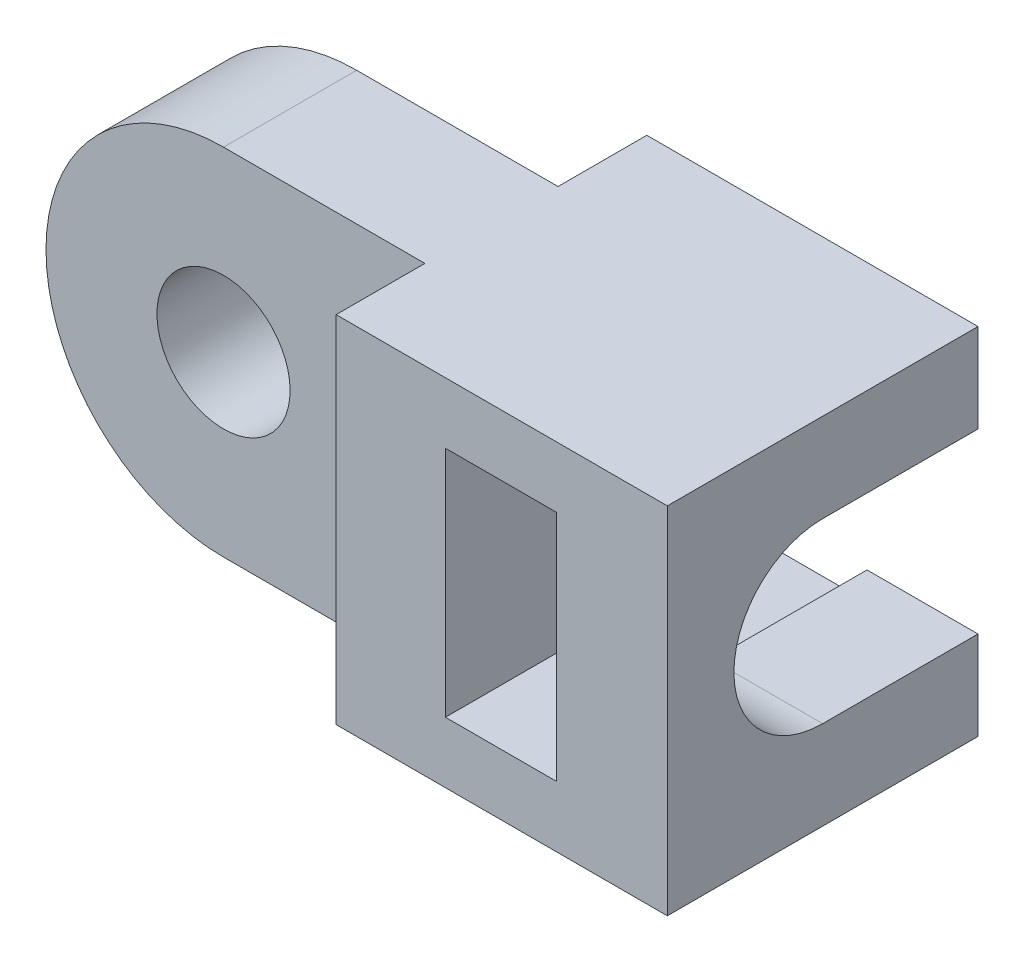
from build123d import *

# Parameters (mm, degrees)
SKETCH1_R               = 1.5
BOSS_EXTRUDE1_DEPTH     = 1.5
SKETCH5_W               = 7.463090523
SKETCH5_H               = 8
BOSS_EXTRUDE2_DEPTH     = 3.5
CUT_EXTRUDE1_DEPTH      = 7
CUT_EXTRUDE1_DEPTH_BACK = 6
SKETCH2_W               = 2.5
SKETCH2_H               = 5.25
SKETCH3_R               = 2
CUT_EXTRUDE2_DEPTH      = 3
SKETCH6_W               = 5
SKETCH6_H               = 4
CUT_EXTRUDE3_DEPTH      = 3.5


with BuildPart() as part:
    # Sketch1 → Boss-Extrude1 (new, symmetric)
    with BuildSketch(Plane.XY):
        with BuildLine():
            Line((12, 4), (0, 4))
            ThreePointArc((0, 4), (-4, 0), (0, -4))
            Line((0, -4), (12, -4))
            Line((12, -4), (12, 4))
        make_face()
        Circle(SKETCH1_R, mode=Mode.SUBTRACT)
    extrude(amount=BOSS_EXTRUDE1_DEPTH, both=True)

    # Sketch5 → Boss-Extrude2 (add, symmetric)
    with BuildSketch(Plane.XY):
        with Locations((8.268454739, 0)):
            Rectangle(SKETCH5_W, SKETCH5_H)
    extrude(amount=BOSS_EXTRUDE2_DEPTH, both=True)

    # Sketch2 → Cut-Extrude1 (cut, two sides: drawn at the far end of the back side and taken through both)
    with BuildSketch(Plane.XY.offset(1.5).offset(-CUT_EXTRUDE1_DEPTH_BACK)):
        with Locations((8.25, 0)):
            Rectangle(SKETCH2_W, SKETCH2_H)
    extrude(amount=CUT_EXTRUDE1_DEPTH + CUT_EXTRUDE1_DEPTH_BACK, mode=Mode.SUBTRACT)

    # Sketch3 → Cut-Extrude2 (cut)
    with BuildSketch(Plane(origin=(12, 0, 0), x_dir=(0, 0, -1), z_dir=(1, 0, 0))):
        with Locations(Location((0, 0, 0), (0, 0, 90))):
            Circle(SKETCH3_R)
    extrude(amount=-CUT_EXTRUDE2_DEPTH, mode=Mode.SUBTRACT)

    # Sketch6 → Cut-Extrude3 (cut)
    with BuildSketch(Plane(origin=(0, 0, -3.5), x_dir=(-1, 0, 0), z_dir=(0, 0, -1))):
        with Locations((-12, 0)):
            Rectangle(SKETCH6_W, SKETCH6_H)
    extrude(amount=-CUT_EXTRUDE3_DEPTH, mode=Mode.SUBTRACT)


solid = part.part
